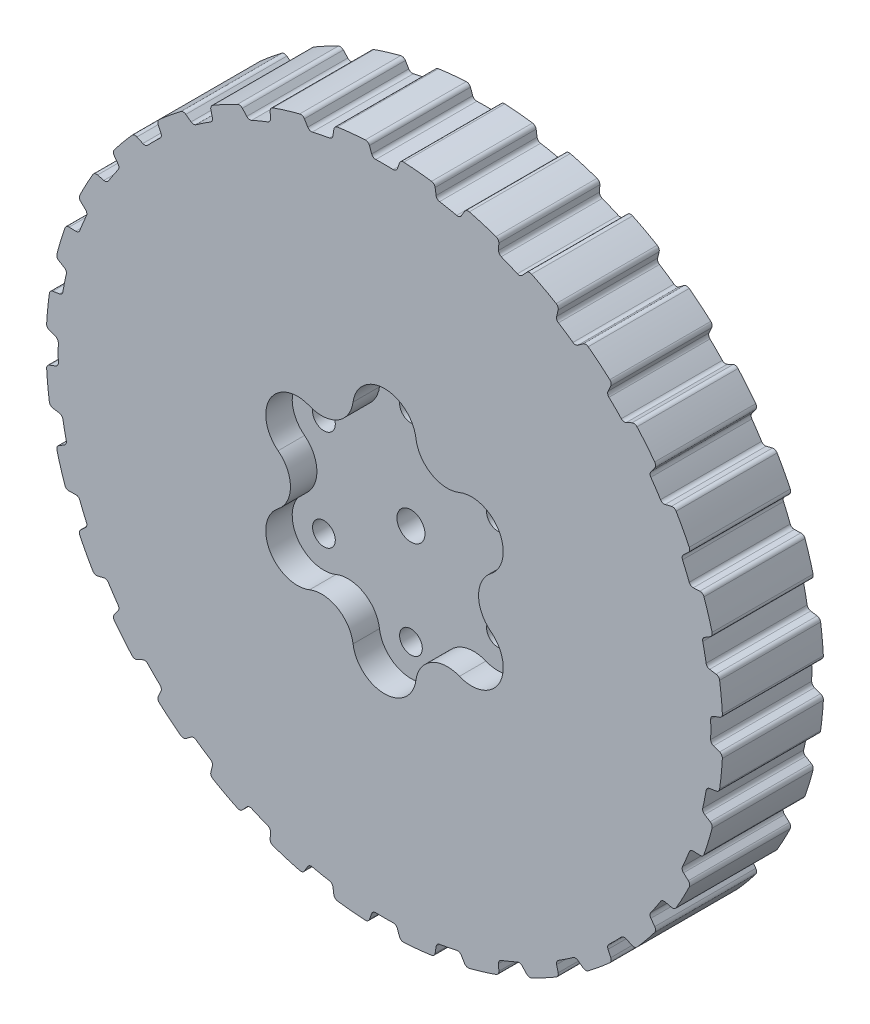
from build123d import *

# Parameters (mm, degrees)
SKETCH_1_R               = 63.994568873
EXTRUDE_1_DEPTH          = 19.1
CUT_EXTRUDE_2_DEPTH      = 93.495511731
PATTERN_CIRCULAR_1_COUNT = 32
CUT_EXTRUDE_START        = 19.1
CUT_EXTRUDE_1_DEPTH      = 5
HOLE_WIZARD_M4_1_D       = 4.3
HOLE_WIZARD_M5_1_D       = 5.3


with BuildPart() as part:
    # ｽｹｯﾁ1 → ﾎﾞｽ - 押し出し1 (new body)
    with BuildSketch(Plane.XY):
        Circle(SKETCH_1_R)
    extrude(amount=EXTRUDE_1_DEPTH)

    # ｽｹｯﾁ5 → ｶｯﾄ - 押し出し2 (cut, through all)
    with BuildSketch(Plane.XY):
        with BuildLine():
            Line((-2.844240519, 63.365789621), (-2.423059507, 62.208604302))
            ThreePointArc((-2.423059507, 62.208604302), (-2.121363458, 61.820822084), (-1.649914265, 61.682506456))
            ThreePointArc((-1.649914265, 61.682506456), (0, 61.704568873), (1.649914265, 61.682506456))
            ThreePointArc((1.649914265, 61.682506456), (2.121363458, 61.820822084), (2.423059507, 62.208604302))
            Line((2.423059507, 62.208604302), (2.844240519, 63.365789621))
            ThreePointArc((2.844240519, 63.365789621), (3.155971997, 63.760290333), (3.641517447, 63.890877251))
            ThreePointArc((3.641517447, 63.890877251), (0, 63.994568873), (-3.641517447, 63.890877251))
            ThreePointArc((-3.641517447, 63.890877251), (-3.155971997, 63.760290333), (-2.844240519, 63.365789621))
        make_face()
    cut_extrude_2 = extrude(amount=CUT_EXTRUDE_2_DEPTH, mode=Mode.SUBTRACT)

    # 円形ﾊﾟﾀｰﾝ1: ｶｯﾄ - 押し出し2 ×32 about axis
    pattern_circular_1_axis = Axis((0, 0, 0), (0, 0, 1))
    for i in range(1, PATTERN_CIRCULAR_1_COUNT):
        add(cut_extrude_2.rotate(pattern_circular_1_axis, i * 360 / PATTERN_CIRCULAR_1_COUNT), mode=Mode.SUBTRACT)

    # ｽｹｯﾁ1<3> → ｶｯﾄ - 押し出し1 (cut)
    with BuildSketch(Plane.XY.offset(CUT_EXTRUDE_START)):
        with BuildLine():
            ThreePointArc((5.946480455, 19.799606275), (0, 25), (-5.946480455, 19.799606275))
            ThreePointArc((-5.946480455, 19.799606275), (-8.892960911, 15.403060127), (-14.173721791, 15.049606275))
            ThreePointArc((-14.173721791, 15.049606275), (-21.650635095, 12.5), (-20.120202247, 4.75))
            ThreePointArc((-20.120202247, 4.75), (-17.785921821, 0), (-20.120202247, -4.75))
            ThreePointArc((-20.120202247, -4.75), (-21.650635095, -12.5), (-14.173721791, -15.049606275))
            ThreePointArc((-14.173721791, -15.049606275), (-8.892960911, -15.403060127), (-5.946480455, -19.799606275))
            ThreePointArc((-5.946480455, -19.799606275), (0, -25), (5.946480455, -19.799606275))
            ThreePointArc((5.946480455, -19.799606275), (8.892960911, -15.403060127), (14.173721791, -15.049606275))
            ThreePointArc((14.173721791, -15.049606275), (21.650635095, -12.5), (20.120202247, -4.75))
            ThreePointArc((20.120202247, -4.75), (17.785921821, 0), (20.120202247, 4.75))
            ThreePointArc((20.120202247, 4.75), (21.650635095, 12.5), (14.173721791, 15.049606275))
            ThreePointArc((14.173721791, 15.049606275), (8.892960911, 15.403060127), (5.946480455, 19.799606275))
        make_face()
    extrude(amount=-CUT_EXTRUDE_1_DEPTH, mode=Mode.SUBTRACT)

    # M4 すきま穴1 (through all)
    with Locations(Plane(origin=(0, 19, 0), x_dir=(-1, 0, 0), z_dir=(0, 0, -1))):
        with Locations((0, 0), (-16.454482672, -9.5), (-16.454482672, -28.5), (0, -38), (16.454482672, -28.5), (16.454482672, -9.5)):
            Hole(HOLE_WIZARD_M4_1_D / 2)

    # M5 すきま穴1 (through all)
    with Locations(Plane(origin=(0, 0, 0), x_dir=(-1, 0, 0), z_dir=(0, 0, -1))):
        with Locations((0, 0)):
            Hole(HOLE_WIZARD_M5_1_D / 2)


solid = part.part
